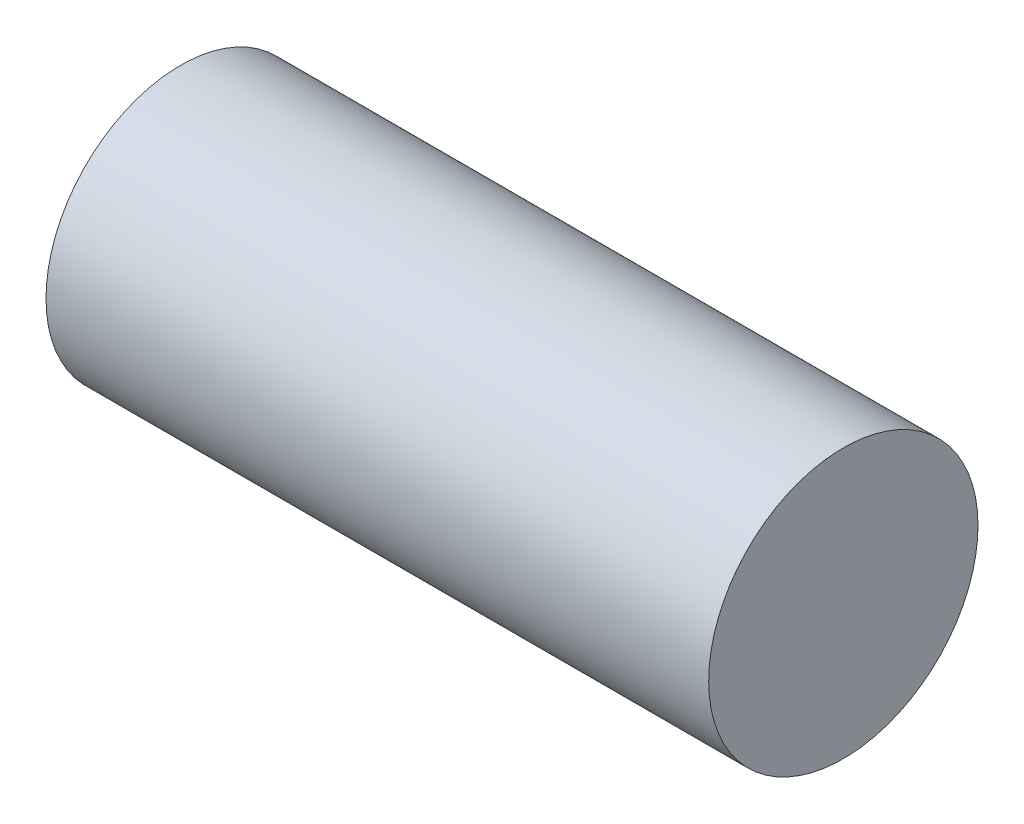
from build123d import *

# Parameters (mm, degrees)
SKETCH1_R           = 30.48
BOSS_EXTRUDE2_DEPTH = 150


with BuildPart() as part:
    # Sketch1 → Boss-Extrude2 (new body)
    with BuildSketch(Plane(origin=(0, 0, 0), x_dir=(0, 0, -1), z_dir=(1, 0, 0))):
        Circle(SKETCH1_R)
    extrude(amount=BOSS_EXTRUDE2_DEPTH)


solid = part.part
